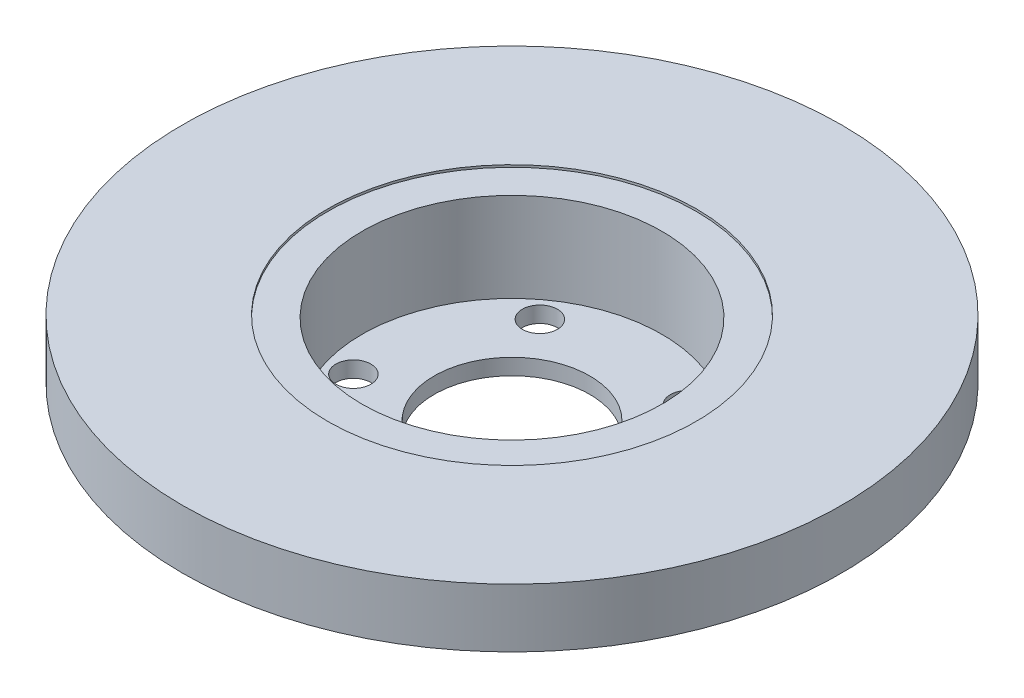
from build123d import *

# Parameters (mm, degrees)
SKETCH1_W               = 290
SKETCH1_H               = 290
BOSS_EXTRUDE1_DEPTH     = 47
SKETCH2_R               = 65.5
CUT_EXTRUDE1_DEPTH      = 40
SKETCH3_R               = 80.5
CUT_EXTRUDE2_DEPTH      = 1
SKETCH4_OUTSIDE_W       = 374.562
SKETCH4_OUTSIDE_H       = 374.562
SKETCH4_OUTSIDE_R       = 74.125
CUT_EXTRUDE3_DEPTH      = 21.33
CUT_EXTRUDE4_DEPTH      = 413.806249953
CUT_EXTRUDE4_DEPTH_BACK = 413.806249953
SKETCH5_R               = 34
CUT_EXTRUDE5_DEPTH      = 413.806249953
CUT_EXTRUDE5_DEPTH_BACK = 413.806249953
SKETCH6_R               = 7.65
SKETCH7_R               = 80.5
SKETCH7_R_2             = 74.125
CUT_EXTRUDE6_DEPTH      = 15
SKETCH8_W               = 4
SKETCH8_H               = 55
CUT_EXTRUDE7_DEPTH      = 2
CUT_EXTRUDE8_DEPTH      = 411.92450511
CUT_EXTRUDE8_DEPTH_BACK = 411.92450511
SKETCH9_OUTSIDE_W       = 374.562
SKETCH9_OUTSIDE_H       = 374.562
SKETCH9_OUTSIDE_R       = 144


with BuildPart() as part:
    # Sketch1 → Boss-Extrude1 (new body)
    with BuildSketch(Plane(origin=(0, 0, 0), x_dir=(1, 0, 0), z_dir=(0, 1, 0))):
        with Locations((145, -145)):
            Rectangle(SKETCH1_W, SKETCH1_H)
    extrude(amount=BOSS_EXTRUDE1_DEPTH)

    # Sketch2 → Cut-Extrude1 (cut)
    with BuildSketch(Plane(origin=(0, 47, 0), x_dir=(1, 0, 0), z_dir=(0, 1, 0))):
        with Locations(Location((145, -145, 0), (0, 0, 270))):
            Circle(SKETCH2_R)
    extrude(amount=-CUT_EXTRUDE1_DEPTH, mode=Mode.SUBTRACT)

    # Sketch3 → Cut-Extrude2 (cut)
    with BuildSketch(Plane(origin=(0, 47, 0), x_dir=(1, 0, 0), z_dir=(0, 1, 0))):
        with Locations(Location((145, -145, 0), (0, 0, 270))):
            Circle(SKETCH3_R)
    extrude(amount=-CUT_EXTRUDE2_DEPTH, mode=Mode.SUBTRACT)

    # Sketch4 outside → Cut-Extrude3 (cut)
    with BuildSketch(Plane.XZ):
        with Locations((145, 145)):
            Rectangle(SKETCH4_OUTSIDE_W, SKETCH4_OUTSIDE_H)
        with Locations(Location((145, 145, 0), (0, 0, 270))):
            Circle(SKETCH4_OUTSIDE_R, mode=Mode.SUBTRACT)
    extrude(amount=-CUT_EXTRUDE3_DEPTH, mode=Mode.SUBTRACT)

    # Sketch5 → Cut-Extrude4 (cut, two sides: drawn at the far end of the back side and taken through both)
    with BuildSketch(Plane.XZ.offset(-CUT_EXTRUDE4_DEPTH_BACK)):
        with Locations(Location((145, 145, 0), (0, 0, 90))):
            Circle(SKETCH5_R)
    extrude(amount=CUT_EXTRUDE4_DEPTH + CUT_EXTRUDE4_DEPTH_BACK, mode=Mode.SUBTRACT)

    # Sketch6 → Cut-Extrude5 (cut, two sides: drawn at the far end of the back side and taken through both)
    with BuildSketch(Plane.XZ.offset(-CUT_EXTRUDE5_DEPTH_BACK)):
        with Locations(Location((145, 200, 0), (0, 0, 90))):
            Circle(SKETCH6_R)
        with Locations(Location((197.308108396, 161.995934691, 0), (0, 0, 90))):
            Circle(SKETCH6_R)
        with Locations(Location((177.328188876, 100.504065309, 0), (0, 0, 90))):
            Circle(SKETCH6_R)
        with Locations(Location((112.671811124, 100.504065309, 0), (0, 0, 90))):
            Circle(SKETCH6_R)
        with Locations(Location((92.691891604, 161.995934691, 0), (0, 0, 90))):
            Circle(SKETCH6_R)
    extrude(amount=CUT_EXTRUDE5_DEPTH + CUT_EXTRUDE5_DEPTH_BACK, mode=Mode.SUBTRACT)

    # Sketch7 → Cut-Extrude6 (cut)
    with BuildSketch(Plane.XZ.offset(-21.33)):
        with Locations(Location((145, 145, 0), (0, 0, 90))):
            Circle(SKETCH7_R)
        with Locations(Location((145, 145, 0), (0, 0, 270))):
            Circle(SKETCH7_R_2, mode=Mode.SUBTRACT)
    extrude(amount=-CUT_EXTRUDE6_DEPTH, mode=Mode.SUBTRACT)

    # Sketch8 → Cut-Extrude7 (cut)
    with BuildSketch(Plane.XZ.offset(-21.33)):
        Polygon((254.921555667, 230.101419493), (211.920824131, 195.809480391), (209.426864924, 198.936806321), (252.427596459, 233.228745423), align=None)
        with Locations((145, 256.5)):
            Rectangle(SKETCH8_W, SKETCH8_H)
        Polygon((280.069937925, 112.119734356), (226.448902755, 124.358385723), (227.338986491, 128.258097372), (280.960021661, 116.019446004), align=None)
        Polygon((203.507902002, 18.897559883), (179.64429635, 68.450847618), (183.248171822, 70.186382574), (207.111777473, 20.63309484), align=None)
        Polygon((82.888222527, 20.63309484), (106.751828178, 70.186382574), (110.35570365, 68.450847618), (86.492097998, 18.897559883), align=None)
        Polygon((9.039978339, 116.019446004), (62.661013509, 128.258097372), (63.551097245, 124.358385723), (9.930062075, 112.119734356), align=None)
        Polygon((37.572403541, 233.228745423), (80.573135076, 198.936806321), (78.079175869, 195.809480391), (35.078444333, 230.101419493), align=None)
    extrude(amount=-CUT_EXTRUDE7_DEPTH, mode=Mode.SUBTRACT)

    # Sketch9 outside → Cut-Extrude8 (cut, two sides: drawn at the far end of the back side and taken through both)
    with BuildSketch(Plane.XZ.offset(-21.33).offset(-CUT_EXTRUDE8_DEPTH_BACK)):
        with Locations((145, 145)):
            Rectangle(SKETCH9_OUTSIDE_W, SKETCH9_OUTSIDE_H)
        with Locations(Location((145, 145, 0), (0, 0, 270))):
            Circle(SKETCH9_OUTSIDE_R, mode=Mode.SUBTRACT)
    extrude(amount=CUT_EXTRUDE8_DEPTH + CUT_EXTRUDE8_DEPTH_BACK, mode=Mode.SUBTRACT)


solid = part.part
